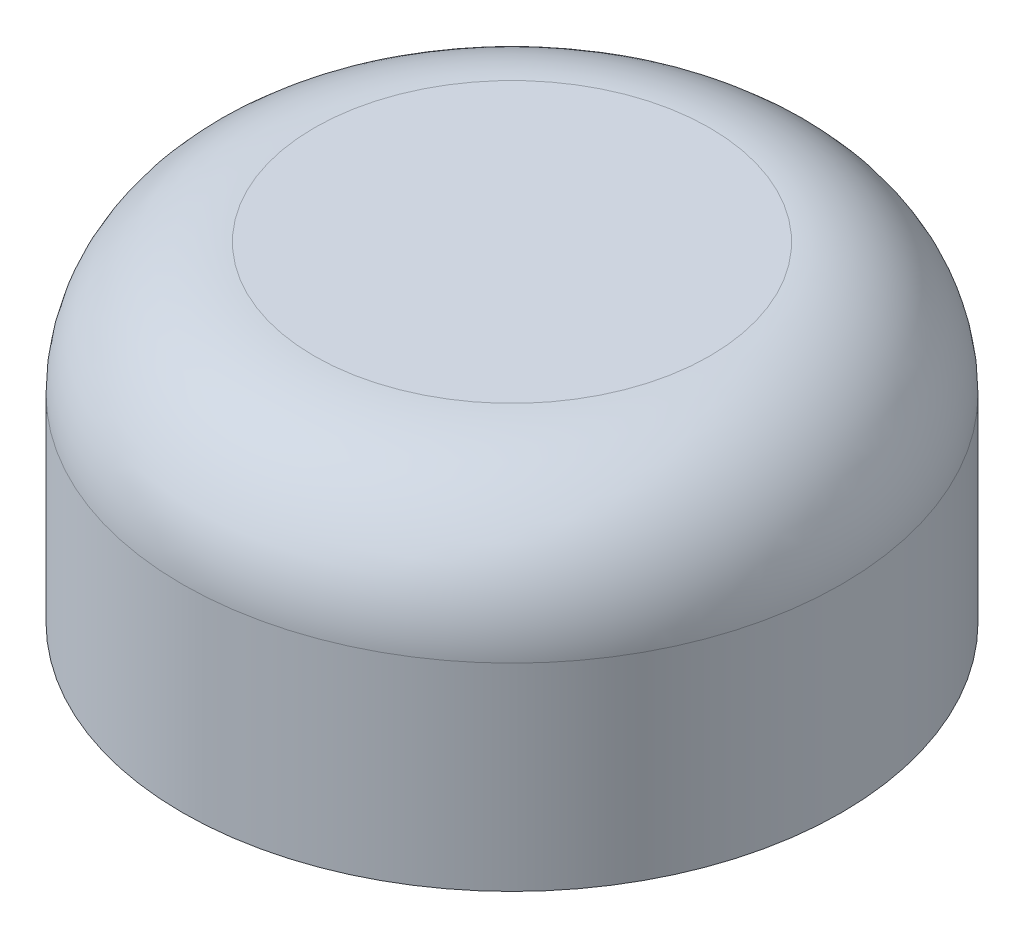
from build123d import *


with BuildPart() as part:
    # Sketch1 → Revolve1 (revolve)
    with BuildSketch(Plane.XY, mode=Mode.PRIVATE) as revolve1_sk:
        with BuildLine():
            Line((53.955184415, 23.715680633), (54.455184415, 23.715680633))
            Line((54.455184415, 23.715680633), (54.455184415, 24.015680633))
            ThreePointArc((54.455184415, 24.015680633), (54.396605771, 24.157101989), (54.255184415, 24.215680633))
            Line((54.255184415, 24.215680633), (53.955184415, 24.215680633))
            Line((53.955184415, 24.215680633), (53.955184415, 23.715680633))
        make_face()
    revolve(revolve1_sk.sketch.rotate(Axis((53.955184415, 24.215680633, 0), (0, -1, 0)), 90), axis=Axis((53.955184415, 24.215680633, 0), (0, -1, 0)))


solid = part.part
